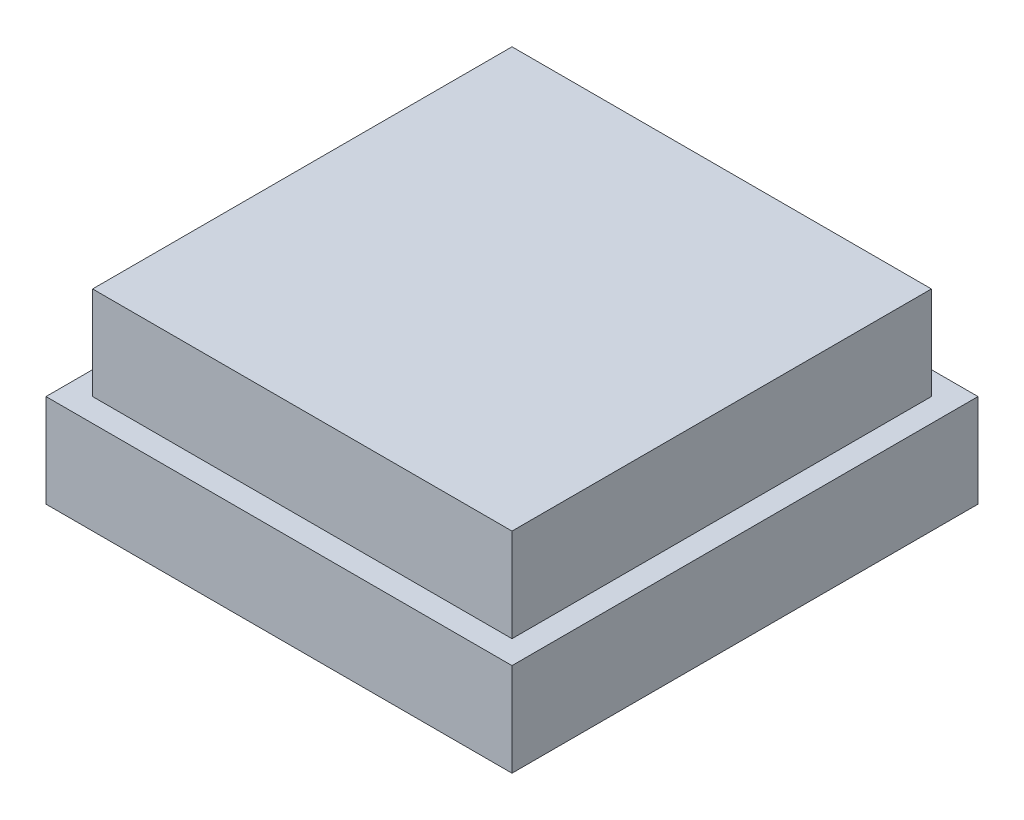
from build123d import *

# Parameters (mm, degrees)
SKETCH1_W           = 50
SKETCH1_H           = 50
BOSS_EXTRUDE1_DEPTH = 10
SKETCH3_W           = 45
SKETCH3_H           = 45
BOSS_EXTRUDE2_DEPTH = 10


with BuildPart() as part:
    # Sketch1 → Boss-Extrude1 (new body)
    with BuildSketch(Plane(origin=(0, 0, 0), x_dir=(1, 0, 0), z_dir=(0, 1, 0))):
        Rectangle(SKETCH1_W, SKETCH1_H)
    extrude(amount=BOSS_EXTRUDE1_DEPTH)

    # Sketch3 → Boss-Extrude2 (add)
    with BuildSketch(Plane(origin=(0, 10, 0), x_dir=(1, 0, 0), z_dir=(0, 1, 0))):
        Rectangle(SKETCH3_W, SKETCH3_H)
    extrude(amount=BOSS_EXTRUDE2_DEPTH)


solid = part.part
